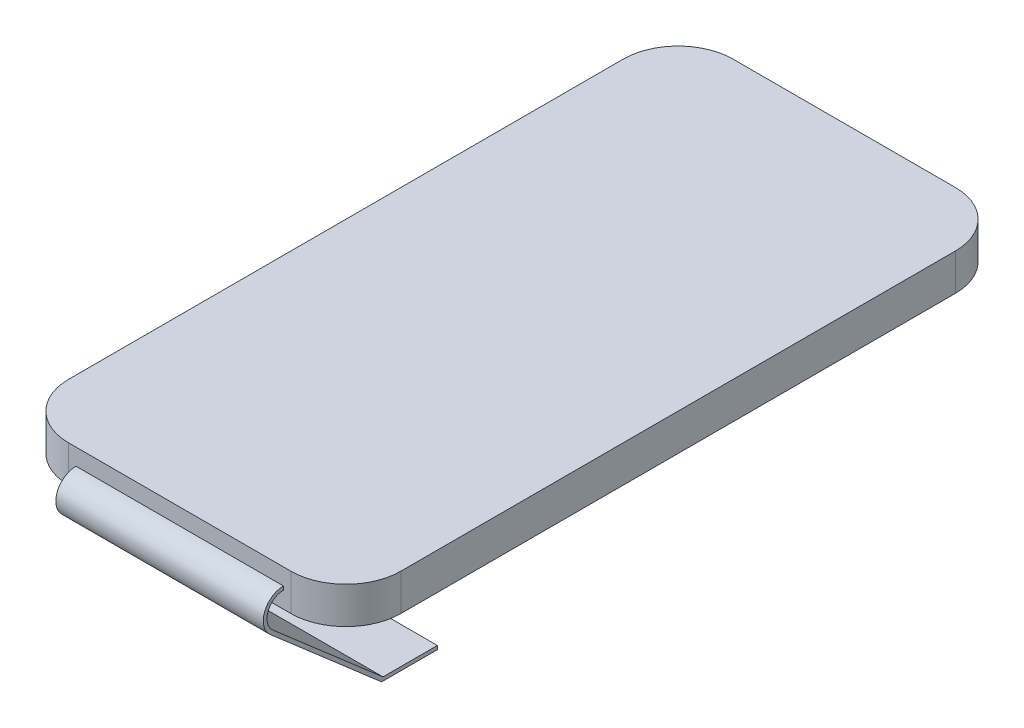
from build123d import *

# Parameters (mm, degrees)
SKETCH_1_W      = 18.1
SKETCH_1_H      = 36.2
EXTRUDE_1_DEPTH = 2
FILLET_1_R      = 3
EXTRUDE_2_DEPTH = 5.65


with BuildPart() as part:
    # 草图1 → 凸台-拉伸1 (new body)
    with BuildSketch(Plane(origin=(0, 0, 0), x_dir=(1, 0, 0), z_dir=(0, 1, 0))):
        Rectangle(SKETCH_1_W, SKETCH_1_H)
    extrude(amount=EXTRUDE_1_DEPTH)

    # 圆角1
    fillet_1_edges = [part.edges().sort_by_distance(p)[0] for p in [
        (9.05, 1, 18.1),
        (-9.05, 1, 18.1),
        (-9.05, 1, -18.1),
        (9.05, 1, -18.1),
    ]]
    fillet(fillet_1_edges, radius=FILLET_1_R)

    # 草图2 → 凸台-拉伸2 (add, symmetric)
    with BuildSketch(Plane(origin=(0, 0, 0), x_dir=(0, 0, -1), z_dir=(1, 0, 0))):
        with BuildLine():
            Line((-18.821174134, -0.830606928), (-12.752189981, -6.1))
            Line((-12.752189981, -6.1), (-9.714835193, -6.1))
            Line((-9.714835193, -6.1), (-9.714835193, -5.9))
            Line((-9.714835193, -5.9), (-12.677480404, -5.9))
            Line((-12.677480404, -5.9), (-18.690051564, -0.679587486))
            ThreePointArc((-18.690051564, -0.679587486), (-18.943098078, 0.314937504), (-18.1, 0.9))
            Line((-18.1, 0.9), (-18.1, 1.1))
            ThreePointArc((-18.1, 1.1), (-19.130453206, 0.384923615), (-18.821174134, -0.830606928))
        make_face()
    extrude(amount=EXTRUDE_2_DEPTH, both=True)


solid = part.part
